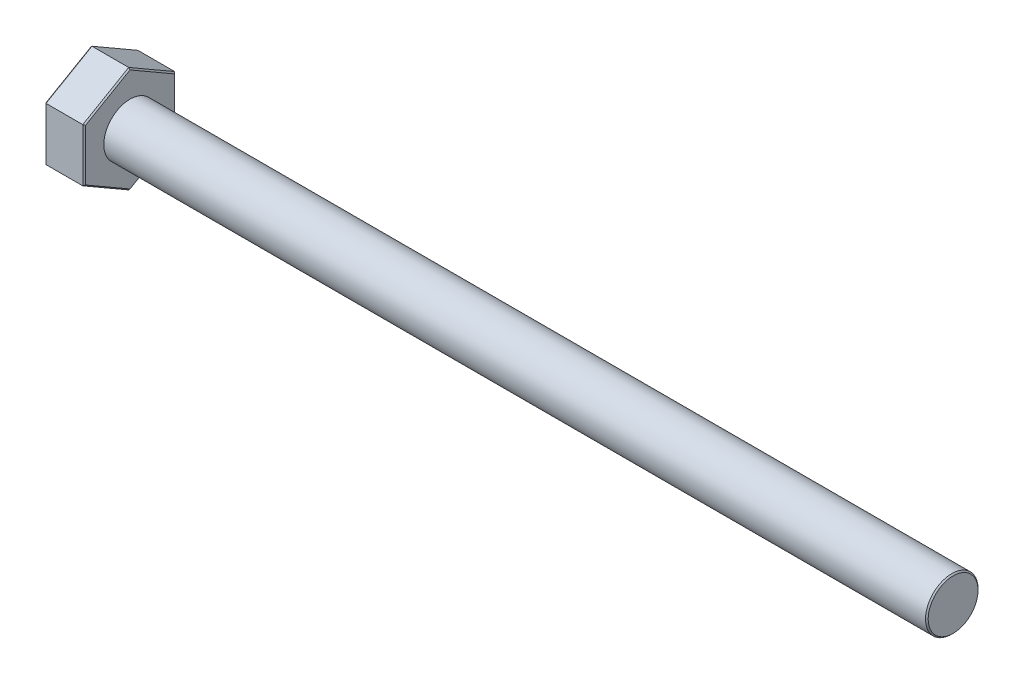
from build123d import *

# Parameters (mm, degrees)
SKETCH1_W           = 62.7
SKETCH1_H           = 2
BOSS_EXTRUDE1_DEPTH = 3
CHAMFER1_SIZE       = 0.1
CHAMFER2_SIZE       = 0.1


with BuildPart() as part:
    # Sketch1 → Revolve1 (revolve)
    with BuildSketch(Plane.XY, mode=Mode.PRIVATE) as revolve1_sk:
        with Locations((31.35, 1)):
            Rectangle(SKETCH1_W, SKETCH1_H)
    revolve(revolve1_sk.sketch.rotate(Axis((-15.554693394, 0, 0), (1, 0, 0)), 90), axis=Axis((-15.554693394, 0, 0), (1, 0, 0)))

    # Sketch2 → Boss-Extrude1 (add)
    with BuildSketch(Plane.ZY):
        Polygon((0, 4.041451884), (-3.5, 2.020725942), (-3.5, -2.020725942), (0, -4.041451884), (3.5, -2.020725942), (3.5, 2.020725942), align=None)
    extrude(amount=BOSS_EXTRUDE1_DEPTH)

    # Chamfer1
    chamfer1_edges = [part.edges().sort_by_distance(p)[0] for p in [
        (0, 3.031088913, -1.75),
        (0, 0, -3.5),
        (0, -3.031088913, -1.75),
        (0, -3.031088913, 1.75),
        (0, 0, 3.5),
        (-3, 3.031088913, 1.75),
        (-3, 3.031088913, -1.75),
        (-3, 0, -3.5),
        (-3, -3.031088913, -1.75),
        (-3, -3.031088913, 1.75),
        (-3, 0, 3.5),
        (0, 3.031088913, 1.75),
    ]]
    chamfer(chamfer1_edges, length=CHAMFER1_SIZE)

    # Chamfer2
    chamfer2_edges = [part.edges().sort_by_distance(p)[0] for p in [
        (62.7, 0, -2),
    ]]
    chamfer(chamfer2_edges, length=CHAMFER2_SIZE)


solid = part.part
